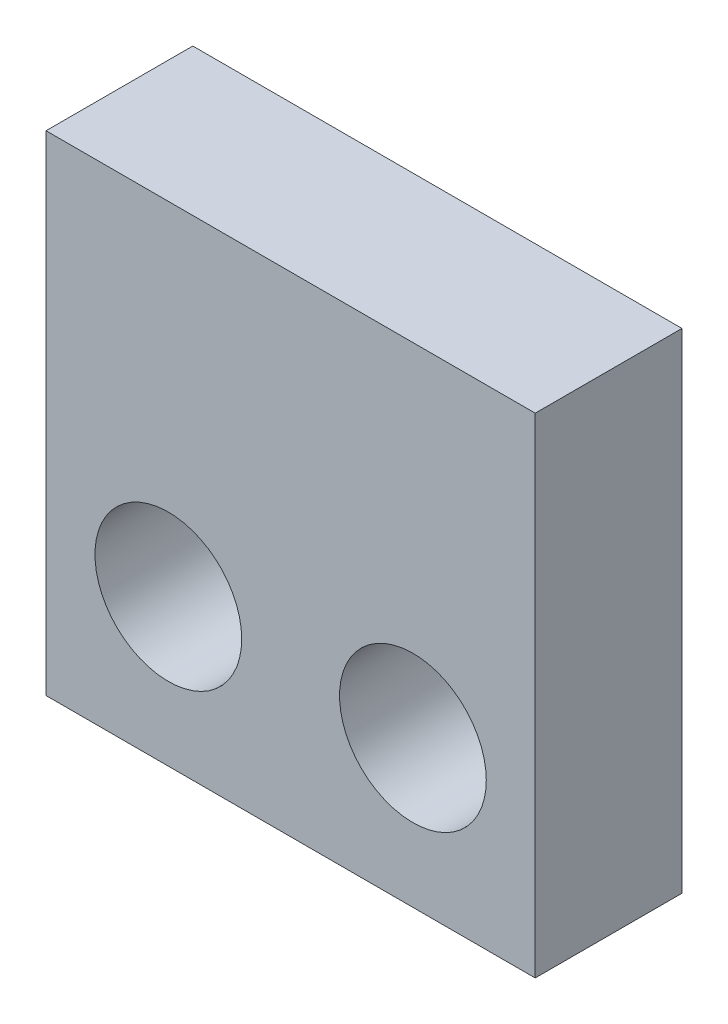
from build123d import *

# Parameters (mm, degrees)
SKETCH1_W           = 10
SKETCH1_H           = 10
SKETCH1_R           = 1.5
BOSS_EXTRUDE1_DEPTH = 3


with BuildPart() as part:
    # Sketch1 → Boss-Extrude1 (new body)
    with BuildSketch(Plane.XY):
        with Locations((2.482993197, 3.707482993)):
            Rectangle(SKETCH1_W, SKETCH1_H)
        with Locations((-0.017006803, 1.707482993)):
            Circle(SKETCH1_R, mode=Mode.SUBTRACT)
        with Locations((4.982993197, 1.707482993)):
            Circle(SKETCH1_R, mode=Mode.SUBTRACT)
    extrude(amount=BOSS_EXTRUDE1_DEPTH)


solid = part.part
